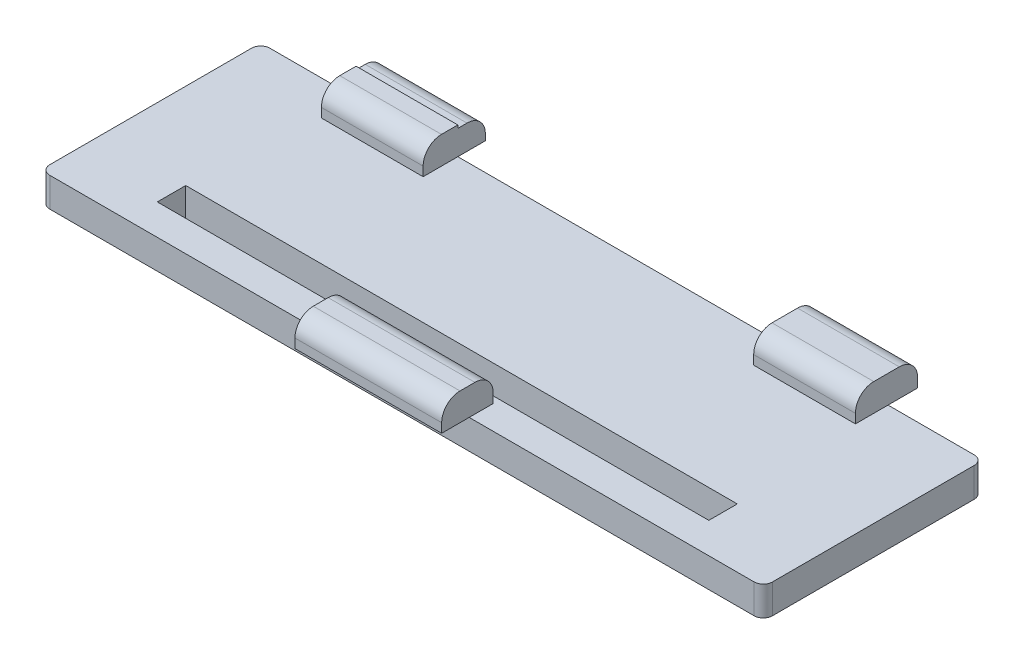
from build123d import *

# Parameters (mm, degrees)
SKETCH1_W           = 39.4
SKETCH1_H           = 12
SKETCH1_W_2         = 30.068441065
SKETCH1_H_2         = 1.551330798
BOSS_EXTRUDE2_DEPTH = 1.6
SKETCH2_W           = 5.546376038
SKETCH2_H           = 1.891525972
SKETCH2_W_2         = 8
SKETCH2_H_2         = 1.312065252
BOSS_EXTRUDE4_DEPTH = 1.5
SKETCH5_W           = 5.546376038
SKETCH5_H           = 1.337693851
BOSS_EXTRUDE5_DEPTH = 1.5
SKETCH7_W           = 5.546376038
SKETCH7_H           = 1.5
BOSS_EXTRUDE6_DEPTH = 1.5
SKETCH9_W           = 8
SKETCH9_H           = 1.5
BOSS_EXTRUDE7_DEPTH = 1.5
FILLET3_R           = 1
FILLET4_R           = 1
FILLET5_R           = 1
FILLET6_R           = 1
FILLET7_R           = 0.5


with BuildPart() as part:
    # Sketch1 → Boss-Extrude2 (new body)
    with BuildSketch(Plane(origin=(0, 0, 0), x_dir=(1, 0, 0), z_dir=(0, 1, 0))):
        with Locations((-3.723847257, 0.850254859)):
            Rectangle(SKETCH1_W, SKETCH1_H)
        with Locations((-3.699480126, -2.702390472)):
            Rectangle(SKETCH1_W_2, SKETCH1_H_2, mode=Mode.SUBTRACT)
    extrude(amount=BOSS_EXTRUDE2_DEPTH)

    # Sketch2 → Boss-Extrude4 (add)
    with BuildSketch(Plane(origin=(0, 1.6, 0), x_dir=(1, 0, 0), z_dir=(0, 1, 0))):
        with Locations((-15.450659238, 5.904491873)):
            Rectangle(SKETCH2_W, SKETCH2_H)
        with Locations((8.004202505, 6.017944023)):
            Rectangle(SKETCH2_W, SKETCH2_H)
        with Locations((-4.058606796, -4.493712515)):
            Rectangle(SKETCH2_W_2, SKETCH2_H_2)
    extrude(amount=BOSS_EXTRUDE4_DEPTH)

    # Sketch5 → Boss-Extrude5 (add)
    with BuildSketch(Plane(origin=(0, 0, -6.850254859), x_dir=(-1, 0, 0), z_dir=(0, 0, -1))):
        with Locations((15.450659238, 2.268846926)):
            Rectangle(SKETCH5_W, SKETCH5_H)
    extrude(amount=BOSS_EXTRUDE5_DEPTH)

    # Sketch7 → Boss-Extrude6 (add)
    with BuildSketch(Plane(origin=(0, 0, -6.963707009), x_dir=(-1, 0, 0), z_dir=(0, 0, -1))):
        with Locations((-8.004202505, 2.35)):
            Rectangle(SKETCH7_W, SKETCH7_H)
    extrude(amount=BOSS_EXTRUDE6_DEPTH)

    # Sketch9 → Boss-Extrude7 (add)
    with BuildSketch(Plane.XY.offset(5.149745141)):
        with Locations((-4.058606796, 2.35)):
            Rectangle(SKETCH9_W, SKETCH9_H)
    extrude(amount=BOSS_EXTRUDE7_DEPTH)

    # Fillet3
    fillet3_edges = [part.edges().sort_by_distance(p)[0] for p in [
        (-4.058606796, 3.1, 6.649745141),
    ]]
    fillet(fillet3_edges, radius=FILLET3_R)

    # Fillet4
    fillet4_edges = [part.edges().sort_by_distance(p)[0] for p in [
        (-15.450659238, 2.937693851, -8.350254859),
        (8.004202505, 3.1, -8.463707009),
    ]]
    fillet(fillet4_edges, radius=FILLET4_R)

    # Fillet5
    fillet5_edges = [part.edges().sort_by_distance(p)[0] for p in [
        (8.004202505, 3.1, -5.072181037),
        (-15.450659238, 3.1, -4.958728887),
    ]]
    fillet(fillet5_edges, radius=FILLET5_R)

    # Fillet6
    fillet6_edges = [part.edges().sort_by_distance(p)[0] for p in [
        (-4.058606796, 3.1, 3.837679889),
    ]]
    fillet(fillet6_edges, radius=FILLET6_R)

    # Fillet7
    fillet7_edges = [part.edges().sort_by_distance(p)[0] for p in [
        (-23.423847257, 0.8, -6.850254859),
        (15.976152743, 0.8, -6.850254859),
        (15.976152743, 0.8, 5.149745141),
        (-23.423847257, 0.8, 5.149745141),
    ]]
    fillet(fillet7_edges, radius=FILLET7_R)


solid = part.part
